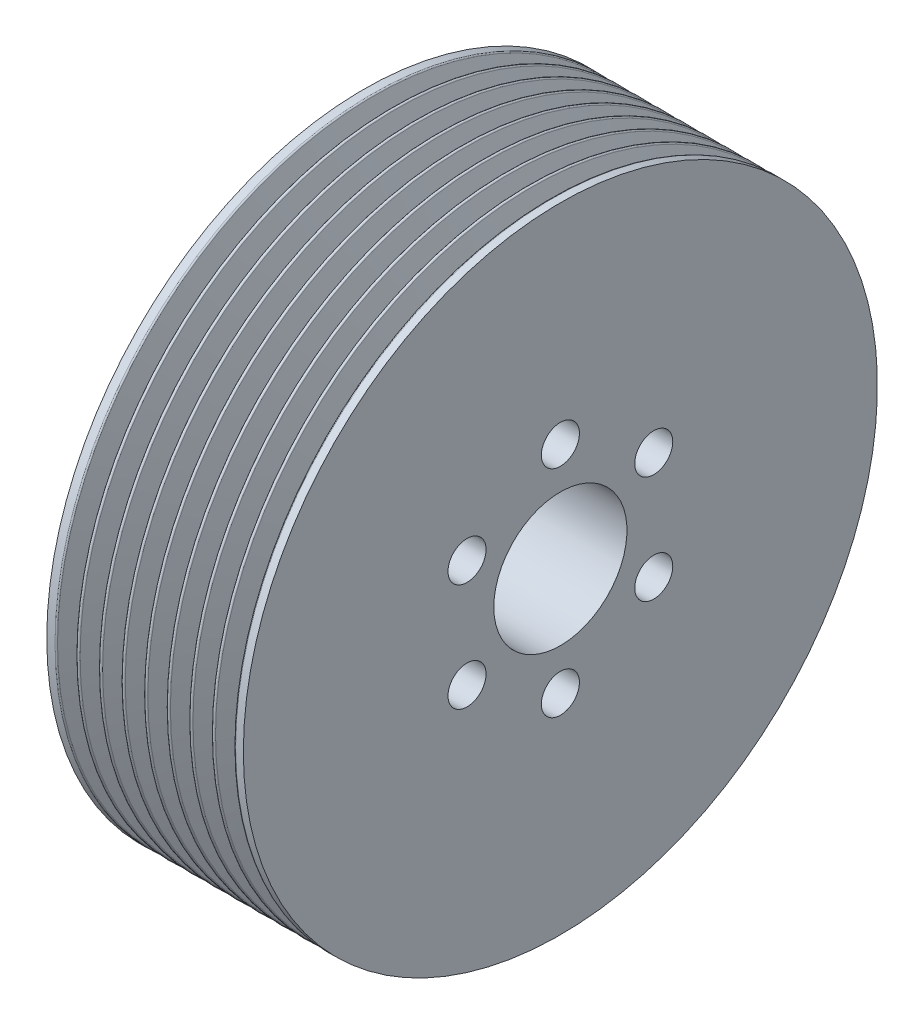
from build123d import *

# Parameters (mm, degrees)
LPATTERN1_COUNT    = 8
LPATTERN1_PITCH    = 3.56
SKETCH3_R          = 3
CUT_EXTRUDE1_DEPTH = 17.5


with BuildPart() as part:
    # Sketch1 → Revolve1 (revolve)
    with BuildSketch(Plane.XY, mode=Mode.PRIVATE) as revolve1_sk:
        Polygon((49, 10.5), (49, 50), (18, 50), (18, 21.5), (31.5, 21.5), (31.5, 10.5), align=None)
    revolve(revolve1_sk.sketch.rotate(Axis((0, 0, 0), (1, 0, 0)), 90), axis=Axis((0, 0, 0), (1, 0, 0)))

    # Sketch2 → Cut-Revolve1 (revolve, cut)
    with BuildSketch(Plane.XY, mode=Mode.PRIVATE) as cut_revolve1_sk:
        with BuildLine():
            Line((47.545076845, 49.835505036), (46.281907786, 46.36497657))
            ThreePointArc((46.281907786, 46.36497657), (46, 46.167582613), (45.718092214, 46.36497657))
            Line((45.718092214, 46.36497657), (44.454923155, 49.835505036))
            ThreePointArc((44.454923155, 49.835505036), (44.363394109, 49.954788011), (44.22, 50))
            Line((44.22, 50), (47.78, 50))
            ThreePointArc((47.78, 50), (47.636605891, 49.954788011), (47.545076845, 49.835505036))
        make_face()
    cut_revolve1 = revolve(cut_revolve1_sk.sketch.rotate(Axis((0, 0, 0), (1, 0, 0)), 90), axis=Axis((0, 0, 0), (1, 0, 0)), mode=Mode.SUBTRACT)

    # LPattern1: Cut-Revolve1 ×8
    with Locations(*[(-i * LPATTERN1_PITCH, 0, 0) for i in range(1, LPATTERN1_COUNT)]):
        add(cut_revolve1, mode=Mode.SUBTRACT)

    # Sketch3 → Cut-Extrude1 (cut)
    with BuildSketch(Plane(origin=(49, 0, 0), x_dir=(0, 0, -1), z_dir=(1, 0, 0))):
        with Locations((0, 17)):
            Circle(SKETCH3_R)
        with Locations((14.722431864, 8.5)):
            Circle(SKETCH3_R)
        with Locations((14.722431864, -8.5)):
            Circle(SKETCH3_R)
        with Locations((0, -17)):
            Circle(SKETCH3_R)
        with Locations((-14.722431864, -8.5)):
            Circle(SKETCH3_R)
        with Locations((-14.722431864, 8.5)):
            Circle(SKETCH3_R)
    extrude(amount=-CUT_EXTRUDE1_DEPTH, mode=Mode.SUBTRACT)


solid = part.part
